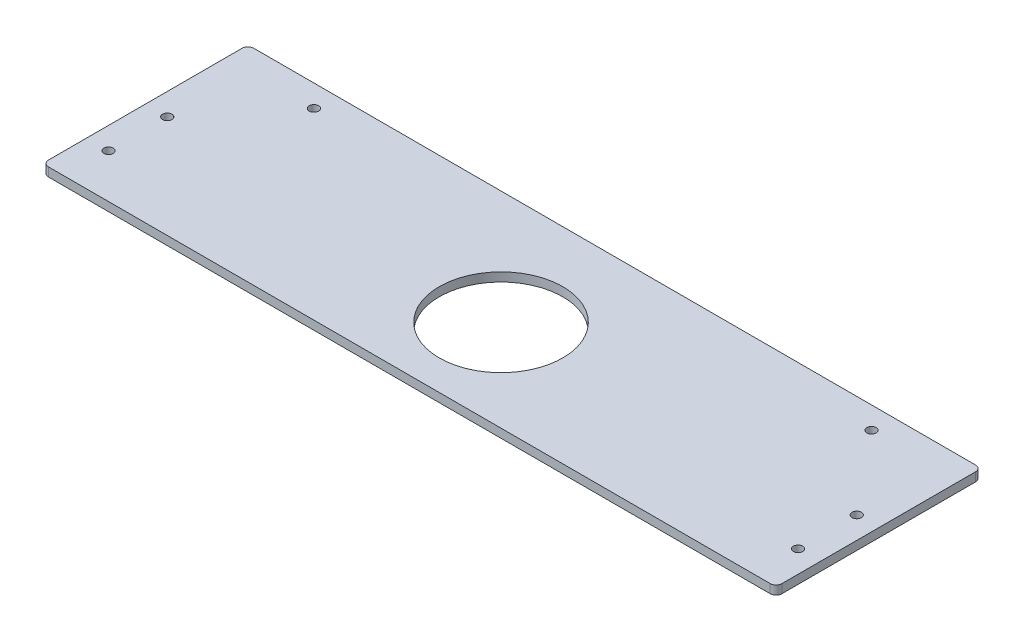
from build123d import *

# Parameters (mm, degrees)
SKETCH_1_W          = 250
SKETCH_1_H          = 70
EXTRUDE_1_DEPTH     = 3
SKETCH_2_R          = 1.6
CUT_EXTRUDE_1_DEPTH = 130.842211934
FILLET_2_R          = 2
SKETCH_3_R          = 21.05
CUT_EXTRUDE_2_DEPTH = 130.842211934


with BuildPart() as part:
    # 草图1 → 凸台-拉伸1 (new body)
    with BuildSketch(Plane(origin=(0, 0, 0), x_dir=(1, 0, 0), z_dir=(0, 1, 0))):
        Rectangle(SKETCH_1_W, SKETCH_1_H)
    extrude(amount=EXTRUDE_1_DEPTH)

    # 草图2 → 切除-拉伸1 (cut, through all)
    with BuildSketch(Plane(origin=(0, 3, 0), x_dir=(1, 0, 0), z_dir=(0, 1, 0))):
        with Locations(Location((-95, 27.5, 0), (0, 0, 270))):
            Circle(SKETCH_2_R)
        with Locations(Location((95, 27.5, 0), (0, 0, 270))):
            Circle(SKETCH_2_R)
        with Locations(Location((-117.5, 0, 0), (0, 0, 270))):
            Circle(SKETCH_2_R)
        with Locations(Location((-117.5, -20, 0), (0, 0, 270))):
            Circle(SKETCH_2_R)
        with Locations(Location((117.5, -20, 0), (0, 0, 90))):
            Circle(SKETCH_2_R)
        with Locations(Location((117.5, 0, 0), (0, 0, 90))):
            Circle(SKETCH_2_R)
    extrude(amount=-CUT_EXTRUDE_1_DEPTH, mode=Mode.SUBTRACT)

    # 圆角2
    fillet_2_edges = [part.edges().sort_by_distance(p)[0] for p in [
        (125, 1.5, 35),
        (-125, 1.5, 35),
        (-125, 1.5, -35),
        (125, 1.5, -35),
    ]]
    fillet(fillet_2_edges, radius=FILLET_2_R)

    # 草图3 → 切除-拉伸2 (cut, through all)
    with BuildSketch(Plane(origin=(0, 3, 0), x_dir=(1, 0, 0), z_dir=(0, 1, 0))):
        with Locations(Location((0, -3.75, 0), (0, 0, 270))):
            Circle(SKETCH_3_R)
    extrude(amount=-CUT_EXTRUDE_2_DEPTH, mode=Mode.SUBTRACT)


solid = part.part
